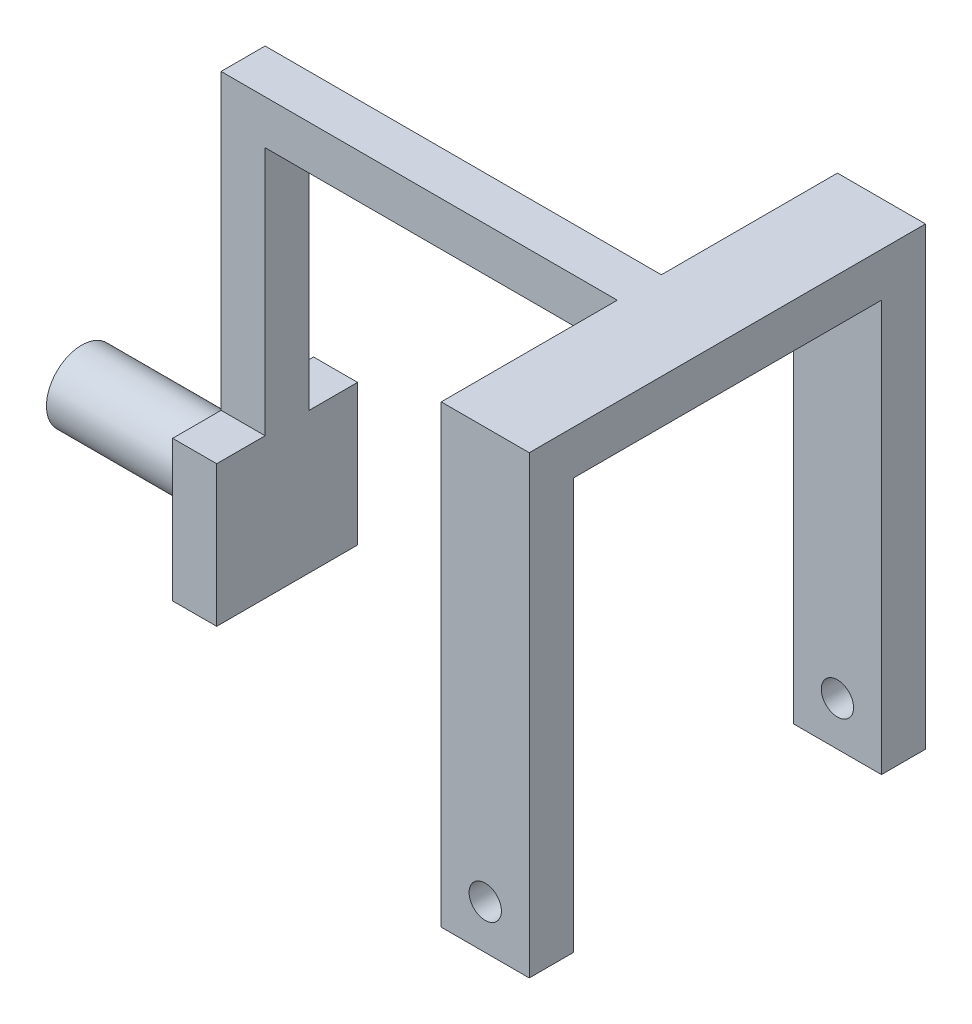
from build123d import *

# Parameters (mm, degrees)
SKETCH1_R                = 12
BOSS_EXTRUDE1_DEPTH      = 55
SKETCH4_W                = 48
SKETCH4_H                = 48
BOSS_EXTRUDE3_DEPTH      = 15
SKETCH5_W                = 15
SKETCH5_H                = 15
BOSS_EXTRUDE4_DEPTH      = 100
SKETCH6_W                = 15
SKETCH6_H                = 15
BOSS_EXTRUDE6_DEPTH      = 150
BOSS_EXTRUDE7_DEPTH      = 60
BOSS_EXTRUDE7_DEPTH_BACK = 75
SKETCH7_W                = 30
SKETCH7_H                = 15
SKETCH8_W                = 30
SKETCH8_H                = 15
BOSS_EXTRUDE8_DEPTH      = 140
SKETCH9_R                = 5.5
CUT_EXTRUDE1_DEPTH       = 287.358167336


with BuildPart() as part:
    # Sketch1 → Boss-Extrude1 (new body)
    with BuildSketch(Plane(origin=(0, 0, 0), x_dir=(0, 0, -1), z_dir=(1, 0, 0))):
        Circle(SKETCH1_R)
    extrude(amount=BOSS_EXTRUDE1_DEPTH)

    # Sketch4 → Boss-Extrude3 (add)
    with BuildSketch(Plane(origin=(55, 0, 0), x_dir=(0, 0, -1), z_dir=(1, 0, 0))):
        Rectangle(SKETCH4_W, SKETCH4_H)
    extrude(amount=BOSS_EXTRUDE3_DEPTH)

    # Sketch5 → Boss-Extrude4 (add)
    with BuildSketch(Plane(origin=(0, 24, 0), x_dir=(1, 0, 0), z_dir=(0, 1, 0))):
        with Locations((62.5, 0)):
            Rectangle(SKETCH5_W, SKETCH5_H)
    extrude(amount=BOSS_EXTRUDE4_DEPTH)

    # Sketch6 → Boss-Extrude6 (add)
    with BuildSketch(Plane(origin=(70, 0, 0), x_dir=(0, 0, -1), z_dir=(1, 0, 0))):
        with Locations((0, 116.5)):
            Rectangle(SKETCH6_W, SKETCH6_H)
    extrude(amount=BOSS_EXTRUDE6_DEPTH)

    # Sketch7 → Boss-Extrude7 (add, two sides: drawn at the far end of the back side and taken through both)
    with BuildSketch(Plane(origin=(0, 0, -7.5), x_dir=(-1, 0, 0), z_dir=(0, 0, -1)).offset(-BOSS_EXTRUDE7_DEPTH_BACK)):
        with Locations((-205, 116.5)):
            Rectangle(SKETCH7_W, SKETCH7_H)
    extrude(amount=BOSS_EXTRUDE7_DEPTH + BOSS_EXTRUDE7_DEPTH_BACK)

    # Sketch8 → Boss-Extrude8 (add)
    with BuildSketch(Plane.XZ.offset(-109)):
        with Locations((205, -60)):
            Rectangle(SKETCH8_W, SKETCH8_H)
        with Locations((205, 60)):
            Rectangle(SKETCH8_W, SKETCH8_H)
    extrude(amount=BOSS_EXTRUDE8_DEPTH)

    # Sketch9 → Cut-Extrude1 (cut, through all)
    with BuildSketch(Plane.XY.offset(67.5)):
        with Locations((205, -16)):
            Circle(SKETCH9_R)
    extrude(amount=-CUT_EXTRUDE1_DEPTH, mode=Mode.SUBTRACT)


solid = part.part
